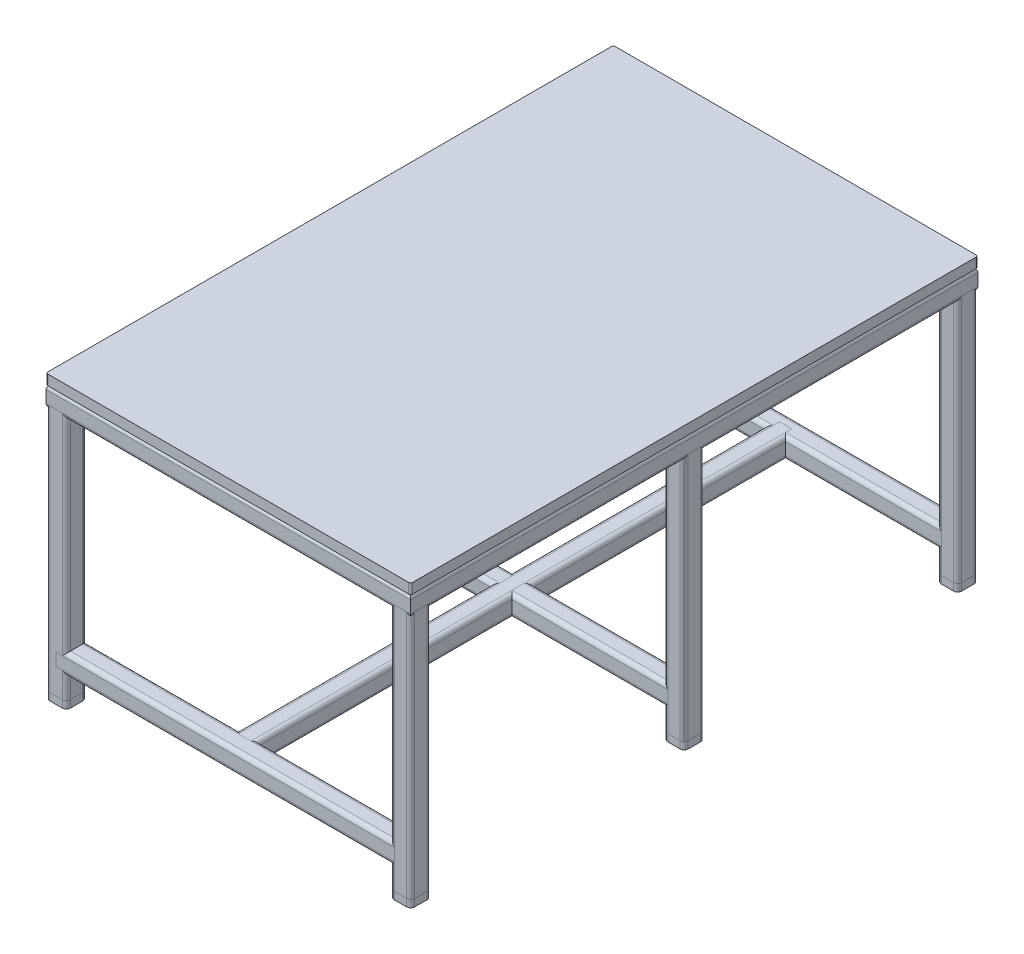
from build123d import *

# Parameters (mm, degrees)
SQUARE_TUBE_20_X_20_X_2_37_DEPTH      = 353.408396927
SQUARE_TUBE_20_X_20_X_2_37_DEPTH_BACK = 15.142135624
SQUARE_TUBE_20_X_20_X_2_37_2_DEPTH    = 567.662043607
SQUARE_TUBE_20_X_20_X_2_37_3_DEPTH    = 368.55053255
SQUARE_TUBE_20_X_20_X_2_37_4_DEPTH    = 567.662043607
SKETCH14_W                            = 358.266261302
SKETCH14_H                            = 557.377772359
BOSS_EXTRUDE1_DEPTH                   = 10
SQUARE_TUBE_20_X_20_X_2_6_DEPTH       = 250
SQUARE_TUBE_20_X_20_X_2_6_2_DEPTH     = 250
FILLET4_R                             = 2
SQUARE_TUBE_20_X_20_X_2_11_DEPTH      = 338.266261303
SQUARE_TUBE_20_X_20_X_2_44_DEPTH      = 250
SQUARE_TUBE_20_X_20_X_2_44_2_DEPTH    = 250
SQUARE_TUBE_20_X_20_X_2_44_3_DEPTH    = 250
SQUARE_TUBE_20_X_20_X_2_44_4_DEPTH    = 250
SQUARE_TUBE_20_X_20_X_2_44_5_DEPTH    = 250
SQUARE_TUBE_20_X_20_X_2_44_6_DEPTH    = 250
BOSS_EXTRUDE2_DEPTH                   = 7.127154383
BOSS_EXTRUDE2_2_DEPTH                 = 7.127154383
BOSS_EXTRUDE2_3_DEPTH                 = 7.127154383
BOSS_EXTRUDE2_4_DEPTH                 = 7.127154383
BOSS_EXTRUDE2_5_DEPTH                 = 7.127154383
BOSS_EXTRUDE2_6_DEPTH                 = 7.127154383
SQUARE_TUBE_20_X_20_X_2_46_DEPTH      = 338.266261303
SQUARE_TUBE_20_X_20_X_2_46_2_DEPTH    = 338.266261303
SQUARE_TUBE_20_X_20_X_2_46_3_DEPTH    = 338.266261303
SQUARE_TUBE_20_X_20_X_2_47_DEPTH      = 537.377772359


with BuildPart() as part:
    # Sketch116 → Square tube 20 X 20 X 2(37) (new, two sides: drawn at the far end of the back side and taken through both)
    with BuildSketch(Plane(origin=(-169.133130651, 187.127154383, 0), x_dir=(0, 1, 0), z_dir=(1, 0, 0)).offset(-SQUARE_TUBE_20_X_20_X_2_37_DEPTH_BACK)):
        with BuildLine():
            Line((-6, -10), (6, -10))
            ThreePointArc((6, -10), (8.828427125, -8.828427125), (10, -6))
            Line((10, -6), (10, 6))
            ThreePointArc((10, 6), (8.828427125, 8.828427125), (6, 10))
            Line((6, 10), (-6, 10))
            ThreePointArc((-6, 10), (-8.828427125, 8.828427125), (-10, 6))
            Line((-10, 6), (-10, -6))
            ThreePointArc((-10, -6), (-8.828427125, -8.828427125), (-6, -10))
        make_face()
        with BuildLine():
            Line((-6, -8), (6, -8))
            ThreePointArc((6, -8), (7.414213562, -7.414213562), (8, -6))
            Line((8, -6), (8, 6))
            ThreePointArc((8, 6), (7.414213562, 7.414213562), (6, 8))
            Line((6, 8), (-6, 8))
            ThreePointArc((-6, 8), (-7.414213562, 7.414213562), (-8, 6))
            Line((-8, 6), (-8, -6))
            ThreePointArc((-8, -6), (-7.414213562, -7.414213562), (-6, -8))
        make_face(mode=Mode.SUBTRACT)
    extrude(amount=SQUARE_TUBE_20_X_20_X_2_37_DEPTH + SQUARE_TUBE_20_X_20_X_2_37_DEPTH_BACK)

    # Square tube 20 X 20 X 2(37) mitre 1
    split(bisect_by=Plane(origin=(-169.133130651, 187.127154383, 0), x_dir=(0, 1, 0), z_dir=(0.707106781, 0, 0.707106781)), keep=Keep.TOP)

    # Square tube 20 X 20 X 2(37) mitre 2
    split(bisect_by=Plane(origin=(169.133130651, 187.127154383, 0), x_dir=(0, -1, 0), z_dir=(-0.707106781, 0, 0.707106781)), keep=Keep.TOP)


with BuildPart() as body_2:
    # Sketch116 on segment 2 (carried to segment 2) → Square tube 20 X 20 X 2_37 2 (new body)
    with BuildSketch(Plane(origin=(169.133130651, 187.127154383, 15.142135624), x_dir=(0, 1, 0), z_dir=(0, 0, -1))):
        with BuildLine():
            Line((-6, -10), (6, -10))
            ThreePointArc((6, -10), (8.828427125, -8.828427125), (10, -6))
            Line((10, -6), (10, 6))
            ThreePointArc((10, 6), (8.828427125, 8.828427125), (6, 10))
            Line((6, 10), (-6, 10))
            ThreePointArc((-6, 10), (-8.828427125, 8.828427125), (-10, 6))
            Line((-10, 6), (-10, -6))
            ThreePointArc((-10, -6), (-8.828427125, -8.828427125), (-6, -10))
        make_face()
        with BuildLine():
            Line((-6, -8), (6, -8))
            ThreePointArc((6, -8), (7.414213562, -7.414213562), (8, -6))
            Line((8, -6), (8, 6))
            ThreePointArc((8, 6), (7.414213562, 7.414213562), (6, 8))
            Line((6, 8), (-6, 8))
            ThreePointArc((-6, 8), (-7.414213562, 7.414213562), (-8, 6))
            Line((-8, 6), (-8, -6))
            ThreePointArc((-8, -6), (-7.414213562, -7.414213562), (-6, -8))
        make_face(mode=Mode.SUBTRACT)
    extrude(amount=SQUARE_TUBE_20_X_20_X_2_37_2_DEPTH)

    # Square tube 20 X 20 X 2_37 2 mitre 1
    split(bisect_by=Plane(origin=(169.133130651, 187.127154383, -537.377772359), x_dir=(0, 1, 0), z_dir=(0.707106781, 0, 0.707106781)), keep=Keep.TOP)

    # Square tube 20 X 20 X 2_37 2 mitre 2
    split(bisect_by=Plane(origin=(169.133130651, 187.127154383, 0), x_dir=(0, 1, 0), z_dir=(0.707106781, 0, -0.707106781)), keep=Keep.TOP)


with BuildPart() as body_3:
    # Sketch116 on segment 3 (carried to segment 3) → Square tube 20 X 20 X 2_37 3 (new body)
    with BuildSketch(Plane(origin=(184.275266275, 187.127154383, -537.377772359), x_dir=(0, 1, 0), z_dir=(-1, 0, 0))):
        with BuildLine():
            Line((-6, -10), (6, -10))
            ThreePointArc((6, -10), (8.828427125, -8.828427125), (10, -6))
            Line((10, -6), (10, 6))
            ThreePointArc((10, 6), (8.828427125, 8.828427125), (6, 10))
            Line((6, 10), (-6, 10))
            ThreePointArc((-6, 10), (-8.828427125, 8.828427125), (-10, 6))
            Line((-10, 6), (-10, -6))
            ThreePointArc((-10, -6), (-8.828427125, -8.828427125), (-6, -10))
        make_face()
        with BuildLine():
            Line((-6, -8), (6, -8))
            ThreePointArc((6, -8), (7.414213562, -7.414213562), (8, -6))
            Line((8, -6), (8, 6))
            ThreePointArc((8, 6), (7.414213562, 7.414213562), (6, 8))
            Line((6, 8), (-6, 8))
            ThreePointArc((-6, 8), (-7.414213562, 7.414213562), (-8, 6))
            Line((-8, 6), (-8, -6))
            ThreePointArc((-8, -6), (-7.414213562, -7.414213562), (-6, -8))
        make_face(mode=Mode.SUBTRACT)
    extrude(amount=SQUARE_TUBE_20_X_20_X_2_37_3_DEPTH)

    # Square tube 20 X 20 X 2_37 3 mitre 1
    split(bisect_by=Plane(origin=(-169.133130651, 187.127154383, -537.377772359), x_dir=(0, 1, 0), z_dir=(0.707106781, 0, -0.707106781)), keep=Keep.TOP)

    # Square tube 20 X 20 X 2_37 3 mitre 2
    split(bisect_by=Plane(origin=(169.133130651, 187.127154383, -537.377772359), x_dir=(0, -1, 0), z_dir=(-0.707106781, 0, -0.707106781)), keep=Keep.TOP)


with BuildPart() as body_4:
    # Sketch116 on segment 4 (carried to segment 4) → Square tube 20 X 20 X 2_37 4 (new body)
    with BuildSketch(Plane(origin=(-169.133130651, 187.127154383, -552.519907983), x_dir=(0, 1, 0), z_dir=(0, 0, 1))):
        with BuildLine():
            Line((-6, -10), (6, -10))
            ThreePointArc((6, -10), (8.828427125, -8.828427125), (10, -6))
            Line((10, -6), (10, 6))
            ThreePointArc((10, 6), (8.828427125, 8.828427125), (6, 10))
            Line((6, 10), (-6, 10))
            ThreePointArc((-6, 10), (-8.828427125, 8.828427125), (-10, 6))
            Line((-10, 6), (-10, -6))
            ThreePointArc((-10, -6), (-8.828427125, -8.828427125), (-6, -10))
        make_face()
        with BuildLine():
            Line((-6, -8), (6, -8))
            ThreePointArc((6, -8), (7.414213562, -7.414213562), (8, -6))
            Line((8, -6), (8, 6))
            ThreePointArc((8, 6), (7.414213562, 7.414213562), (6, 8))
            Line((6, 8), (-6, 8))
            ThreePointArc((-6, 8), (-7.414213562, 7.414213562), (-8, 6))
            Line((-8, 6), (-8, -6))
            ThreePointArc((-8, -6), (-7.414213562, -7.414213562), (-6, -8))
        make_face(mode=Mode.SUBTRACT)
    extrude(amount=SQUARE_TUBE_20_X_20_X_2_37_4_DEPTH)

    # Square tube 20 X 20 X 2_37 4 mitre 1
    split(bisect_by=Plane(origin=(-169.133130651, 187.127154383, 0), x_dir=(0, -1, 0), z_dir=(-0.707106781, 0, -0.707106781)), keep=Keep.TOP)

    # Square tube 20 X 20 X 2_37 4 mitre 2
    split(bisect_by=Plane(origin=(-169.133130651, 187.127154383, -537.377772359), x_dir=(0, -1, 0), z_dir=(-0.707106781, 0, 0.707106781)), keep=Keep.TOP)


with BuildPart() as body_5:
    # Sketch14 → Boss-Extrude1 (new body)
    with BuildSketch(Plane(origin=(0, 197.127154383, 0), x_dir=(1, 0, 0), z_dir=(0, 1, 0))):
        with Locations((0, 268.68888618)):
            Rectangle(SKETCH14_W, SKETCH14_H)
    extrude(amount=BOSS_EXTRUDE1_DEPTH)

    # Fillet4
    fillet4_edges = [body_5.edges().sort_by_distance(p)[0] for p in [
        (179.133130651, 202.127154383, 10),
        (-179.133130651, 202.127154383, 10),
        (-179.133130651, 202.127154383, -547.377772359),
        (179.133130651, 202.127154383, -547.377772359),
    ]]
    fillet(fillet4_edges, radius=FILLET4_R)


with BuildPart() as body_6:
    # Sketch18 → Square tube 20 X 20 X 2(6) (new body)
    with BuildSketch(Plane(origin=(-169.133130651, 187.127154383, -268.68888618), x_dir=(1, 0, 0), z_dir=(0, -1, 0))):
        with BuildLine():
            Line((-6, -10), (6, -10))
            ThreePointArc((6, -10), (8.828427125, -8.828427125), (10, -6))
            Line((10, -6), (10, 6))
            ThreePointArc((10, 6), (8.828427125, 8.828427125), (6, 10))
            Line((6, 10), (-6, 10))
            ThreePointArc((-6, 10), (-8.828427125, 8.828427125), (-10, 6))
            Line((-10, 6), (-10, -6))
            ThreePointArc((-10, -6), (-8.828427125, -8.828427125), (-6, -10))
        make_face()
        with BuildLine():
            Line((-6, -8), (6, -8))
            ThreePointArc((6, -8), (7.414213562, -7.414213562), (8, -6))
            Line((8, -6), (8, 6))
            ThreePointArc((8, 6), (7.414213562, 7.414213562), (6, 8))
            Line((6, 8), (-6, 8))
            ThreePointArc((-6, 8), (-7.414213562, 7.414213562), (-8, 6))
            Line((-8, 6), (-8, -6))
            ThreePointArc((-8, -6), (-7.414213562, -7.414213562), (-6, -8))
        make_face(mode=Mode.SUBTRACT)
    extrude(amount=SQUARE_TUBE_20_X_20_X_2_6_DEPTH)


with BuildPart() as body_7:
    # Sketch18 on segment 2 (carried to segment 2) → Square tube 20 X 20 X 2_6 2 (new body)
    with BuildSketch(Plane(origin=(169.133130651, 187.127154383, -268.68888618), x_dir=(1, 0, 0), z_dir=(0, -1, 0))):
        with BuildLine():
            Line((-6, -10), (6, -10))
            ThreePointArc((6, -10), (8.828427125, -8.828427125), (10, -6))
            Line((10, -6), (10, 6))
            ThreePointArc((10, 6), (8.828427125, 8.828427125), (6, 10))
            Line((6, 10), (-6, 10))
            ThreePointArc((-6, 10), (-8.828427125, 8.828427125), (-10, 6))
            Line((-10, 6), (-10, -6))
            ThreePointArc((-10, -6), (-8.828427125, -8.828427125), (-6, -10))
        make_face()
        with BuildLine():
            Line((-6, -8), (6, -8))
            ThreePointArc((6, -8), (7.414213562, -7.414213562), (8, -6))
            Line((8, -6), (8, 6))
            ThreePointArc((8, 6), (7.414213562, 7.414213562), (6, 8))
            Line((6, 8), (-6, 8))
            ThreePointArc((-6, 8), (-7.414213562, 7.414213562), (-8, 6))
            Line((-8, 6), (-8, -6))
            ThreePointArc((-8, -6), (-7.414213562, -7.414213562), (-6, -8))
        make_face(mode=Mode.SUBTRACT)
    extrude(amount=SQUARE_TUBE_20_X_20_X_2_6_2_DEPTH)


with BuildPart() as body_8:
    # Sketch110 → Square tube 20 X 20 X 2(11) (new body)
    with BuildSketch(Plane(origin=(-169.133130651, -31.487021705, -268.68888618), x_dir=(0, 0, -1), z_dir=(1, 0, 0))):
        with BuildLine():
            Line((-6, -10), (6, -10))
            ThreePointArc((6, -10), (8.828427125, -8.828427125), (10, -6))
            Line((10, -6), (10, 6))
            ThreePointArc((10, 6), (8.828427125, 8.828427125), (6, 10))
            Line((6, 10), (-6, 10))
            ThreePointArc((-6, 10), (-8.828427125, 8.828427125), (-10, 6))
            Line((-10, 6), (-10, -6))
            ThreePointArc((-10, -6), (-8.828427125, -8.828427125), (-6, -10))
        make_face()
        with BuildLine():
            Line((-6, -8), (6, -8))
            ThreePointArc((6, -8), (7.414213562, -7.414213562), (8, -6))
            Line((8, -6), (8, 6))
            ThreePointArc((8, 6), (7.414213562, 7.414213562), (6, 8))
            Line((6, 8), (-6, 8))
            ThreePointArc((-6, 8), (-7.414213562, 7.414213562), (-8, 6))
            Line((-8, 6), (-8, -6))
            ThreePointArc((-8, -6), (-7.414213562, -7.414213562), (-6, -8))
        make_face(mode=Mode.SUBTRACT)
    extrude(amount=SQUARE_TUBE_20_X_20_X_2_11_DEPTH)


with BuildPart() as body_9:
    # Sketch118 → Square tube 20 X 20 X 2(44) (new body)
    with BuildSketch(Plane(origin=(-169.133130651, 187.127154383, 0), x_dir=(1, 0, 0), z_dir=(0, -1, 0))):
        with BuildLine():
            Line((-6, -10), (6, -10))
            ThreePointArc((6, -10), (8.828427125, -8.828427125), (10, -6))
            Line((10, -6), (10, 6))
            ThreePointArc((10, 6), (8.828427125, 8.828427125), (6, 10))
            Line((6, 10), (-6, 10))
            ThreePointArc((-6, 10), (-8.828427125, 8.828427125), (-10, 6))
            Line((-10, 6), (-10, -6))
            ThreePointArc((-10, -6), (-8.828427125, -8.828427125), (-6, -10))
        make_face()
        with BuildLine():
            Line((-6, -8), (6, -8))
            ThreePointArc((6, -8), (7.414213562, -7.414213562), (8, -6))
            Line((8, -6), (8, 6))
            ThreePointArc((8, 6), (7.414213562, 7.414213562), (6, 8))
            Line((6, 8), (-6, 8))
            ThreePointArc((-6, 8), (-7.414213562, 7.414213562), (-8, 6))
            Line((-8, 6), (-8, -6))
            ThreePointArc((-8, -6), (-7.414213562, -7.414213562), (-6, -8))
        make_face(mode=Mode.SUBTRACT)
    extrude(amount=SQUARE_TUBE_20_X_20_X_2_44_DEPTH)


with BuildPart() as body_10:
    # Sketch118 on segment 2 (carried to segment 2) → Square tube 20 X 20 X 2_44 2 (new body)
    with BuildSketch(Plane(origin=(169.133130651, 187.127154383, 0), x_dir=(1, 0, 0), z_dir=(0, -1, 0))):
        with BuildLine():
            Line((-6, -10), (6, -10))
            ThreePointArc((6, -10), (8.828427125, -8.828427125), (10, -6))
            Line((10, -6), (10, 6))
            ThreePointArc((10, 6), (8.828427125, 8.828427125), (6, 10))
            Line((6, 10), (-6, 10))
            ThreePointArc((-6, 10), (-8.828427125, 8.828427125), (-10, 6))
            Line((-10, 6), (-10, -6))
            ThreePointArc((-10, -6), (-8.828427125, -8.828427125), (-6, -10))
        make_face()
        with BuildLine():
            Line((-6, -8), (6, -8))
            ThreePointArc((6, -8), (7.414213562, -7.414213562), (8, -6))
            Line((8, -6), (8, 6))
            ThreePointArc((8, 6), (7.414213562, 7.414213562), (6, 8))
            Line((6, 8), (-6, 8))
            ThreePointArc((-6, 8), (-7.414213562, 7.414213562), (-8, 6))
            Line((-8, 6), (-8, -6))
            ThreePointArc((-8, -6), (-7.414213562, -7.414213562), (-6, -8))
        make_face(mode=Mode.SUBTRACT)
    extrude(amount=SQUARE_TUBE_20_X_20_X_2_44_2_DEPTH)


with BuildPart() as body_11:
    # Sketch118 on segment 3 (carried to segment 3) → Square tube 20 X 20 X 2_44 3 (new body)
    with BuildSketch(Plane(origin=(169.133130651, 187.127154383, -537.377772359), x_dir=(1, 0, 0), z_dir=(0, -1, 0))):
        with BuildLine():
            Line((-6, -10), (6, -10))
            ThreePointArc((6, -10), (8.828427125, -8.828427125), (10, -6))
            Line((10, -6), (10, 6))
            ThreePointArc((10, 6), (8.828427125, 8.828427125), (6, 10))
            Line((6, 10), (-6, 10))
            ThreePointArc((-6, 10), (-8.828427125, 8.828427125), (-10, 6))
            Line((-10, 6), (-10, -6))
            ThreePointArc((-10, -6), (-8.828427125, -8.828427125), (-6, -10))
        make_face()
        with BuildLine():
            Line((-6, -8), (6, -8))
            ThreePointArc((6, -8), (7.414213562, -7.414213562), (8, -6))
            Line((8, -6), (8, 6))
            ThreePointArc((8, 6), (7.414213562, 7.414213562), (6, 8))
            Line((6, 8), (-6, 8))
            ThreePointArc((-6, 8), (-7.414213562, 7.414213562), (-8, 6))
            Line((-8, 6), (-8, -6))
            ThreePointArc((-8, -6), (-7.414213562, -7.414213562), (-6, -8))
        make_face(mode=Mode.SUBTRACT)
    extrude(amount=SQUARE_TUBE_20_X_20_X_2_44_3_DEPTH)


with BuildPart() as body_12:
    # Sketch118 on segment 4 (carried to segment 4) → Square tube 20 X 20 X 2_44 4 (new body)
    with BuildSketch(Plane(origin=(-169.133130651, 187.127154383, -537.377772359), x_dir=(1, 0, 0), z_dir=(0, -1, 0))):
        with BuildLine():
            Line((-6, -10), (6, -10))
            ThreePointArc((6, -10), (8.828427125, -8.828427125), (10, -6))
            Line((10, -6), (10, 6))
            ThreePointArc((10, 6), (8.828427125, 8.828427125), (6, 10))
            Line((6, 10), (-6, 10))
            ThreePointArc((-6, 10), (-8.828427125, 8.828427125), (-10, 6))
            Line((-10, 6), (-10, -6))
            ThreePointArc((-10, -6), (-8.828427125, -8.828427125), (-6, -10))
        make_face()
        with BuildLine():
            Line((-6, -8), (6, -8))
            ThreePointArc((6, -8), (7.414213562, -7.414213562), (8, -6))
            Line((8, -6), (8, 6))
            ThreePointArc((8, 6), (7.414213562, 7.414213562), (6, 8))
            Line((6, 8), (-6, 8))
            ThreePointArc((-6, 8), (-7.414213562, 7.414213562), (-8, 6))
            Line((-8, 6), (-8, -6))
            ThreePointArc((-8, -6), (-7.414213562, -7.414213562), (-6, -8))
        make_face(mode=Mode.SUBTRACT)
    extrude(amount=SQUARE_TUBE_20_X_20_X_2_44_4_DEPTH)


with BuildPart() as body_13:
    # Sketch118 on segment 5 (carried to segment 5) → Square tube 20 X 20 X 2_44 5 (new body)
    with BuildSketch(Plane(origin=(-169.133130651, 187.127154383, -268.68888618), x_dir=(1, 0, 0), z_dir=(0, -1, 0))):
        with BuildLine():
            Line((-6, -10), (6, -10))
            ThreePointArc((6, -10), (8.828427125, -8.828427125), (10, -6))
            Line((10, -6), (10, 6))
            ThreePointArc((10, 6), (8.828427125, 8.828427125), (6, 10))
            Line((6, 10), (-6, 10))
            ThreePointArc((-6, 10), (-8.828427125, 8.828427125), (-10, 6))
            Line((-10, 6), (-10, -6))
            ThreePointArc((-10, -6), (-8.828427125, -8.828427125), (-6, -10))
        make_face()
        with BuildLine():
            Line((-6, -8), (6, -8))
            ThreePointArc((6, -8), (7.414213562, -7.414213562), (8, -6))
            Line((8, -6), (8, 6))
            ThreePointArc((8, 6), (7.414213562, 7.414213562), (6, 8))
            Line((6, 8), (-6, 8))
            ThreePointArc((-6, 8), (-7.414213562, 7.414213562), (-8, 6))
            Line((-8, 6), (-8, -6))
            ThreePointArc((-8, -6), (-7.414213562, -7.414213562), (-6, -8))
        make_face(mode=Mode.SUBTRACT)
    extrude(amount=SQUARE_TUBE_20_X_20_X_2_44_5_DEPTH)


with BuildPart() as body_14:
    # Sketch118 on segment 6 (carried to segment 6) → Square tube 20 X 20 X 2_44 6 (new body)
    with BuildSketch(Plane(origin=(169.133130651, 187.127154383, -268.68888618), x_dir=(1, 0, 0), z_dir=(0, -1, 0))):
        with BuildLine():
            Line((-6, -10), (6, -10))
            ThreePointArc((6, -10), (8.828427125, -8.828427125), (10, -6))
            Line((10, -6), (10, 6))
            ThreePointArc((10, 6), (8.828427125, 8.828427125), (6, 10))
            Line((6, 10), (-6, 10))
            ThreePointArc((-6, 10), (-8.828427125, 8.828427125), (-10, 6))
            Line((-10, 6), (-10, -6))
            ThreePointArc((-10, -6), (-8.828427125, -8.828427125), (-6, -10))
        make_face()
        with BuildLine():
            Line((-6, -8), (6, -8))
            ThreePointArc((6, -8), (7.414213562, -7.414213562), (8, -6))
            Line((8, -6), (8, 6))
            ThreePointArc((8, 6), (7.414213562, 7.414213562), (6, 8))
            Line((6, 8), (-6, 8))
            ThreePointArc((-6, 8), (-7.414213562, 7.414213562), (-8, 6))
            Line((-8, 6), (-8, -6))
            ThreePointArc((-8, -6), (-7.414213562, -7.414213562), (-6, -8))
        make_face(mode=Mode.SUBTRACT)
    extrude(amount=SQUARE_TUBE_20_X_20_X_2_44_6_DEPTH)


with BuildPart() as body_15:
    # Sketch119 → Boss-Extrude2 (new body)
    with BuildSketch(Plane(origin=(0, -70, 0), x_dir=(1, 0, 0), z_dir=(0, 1, 0))):
        with BuildLine():
            Line((-163.133130651, 527.377772359), (-175.133130651, 527.377772359))
            ThreePointArc((-175.133130651, 527.377772359), (-177.961557776, 528.549345235), (-179.133130651, 531.377772359))
            Line((-179.133130651, 531.377772359), (-179.133130651, 543.377772359))
            ThreePointArc((-179.133130651, 543.377772359), (-177.961557776, 546.206199484), (-175.133130651, 547.377772359))
            Line((-175.133130651, 547.377772359), (-163.133130651, 547.377772359))
            ThreePointArc((-163.133130651, 547.377772359), (-160.304703527, 546.206199484), (-159.133130651, 543.377772359))
            Line((-159.133130651, 543.377772359), (-159.133130651, 531.377772359))
            ThreePointArc((-159.133130651, 531.377772359), (-160.304703527, 528.549345235), (-163.133130651, 527.377772359))
        make_face()
    extrude(amount=BOSS_EXTRUDE2_DEPTH)


with BuildPart() as body_16:
    # Sketch119 → Boss-Extrude2 2 (new body)
    with BuildSketch(Plane(origin=(0, -70, 0), x_dir=(1, 0, 0), z_dir=(0, 1, 0))):
        with BuildLine():
            Line((175.133130651, 527.377772359), (163.133130651, 527.377772359))
            ThreePointArc((163.133130651, 527.377772359), (160.304703527, 528.549345235), (159.133130651, 531.377772359))
            Line((159.133130651, 531.377772359), (159.133130651, 543.377772359))
            ThreePointArc((159.133130651, 543.377772359), (160.304703527, 546.206199484), (163.133130651, 547.377772359))
            Line((163.133130651, 547.377772359), (175.133130651, 547.377772359))
            ThreePointArc((175.133130651, 547.377772359), (177.961557776, 546.206199484), (179.133130651, 543.377772359))
            Line((179.133130651, 543.377772359), (179.133130651, 531.377772359))
            ThreePointArc((179.133130651, 531.377772359), (177.961557776, 528.549345235), (175.133130651, 527.377772359))
        make_face()
    extrude(amount=BOSS_EXTRUDE2_2_DEPTH)


with BuildPart() as body_17:
    # Sketch119 → Boss-Extrude2 3 (new body)
    with BuildSketch(Plane(origin=(0, -70, 0), x_dir=(1, 0, 0), z_dir=(0, 1, 0))):
        with BuildLine():
            Line((175.133130651, 258.68888618), (163.133130651, 258.68888618))
            ThreePointArc((163.133130651, 258.68888618), (160.304703527, 259.860459055), (159.133130651, 262.68888618))
            Line((159.133130651, 262.68888618), (159.133130651, 274.68888618))
            ThreePointArc((159.133130651, 274.68888618), (160.304703527, 277.517313304), (163.133130651, 278.68888618))
            Line((163.133130651, 278.68888618), (175.133130651, 278.68888618))
            ThreePointArc((175.133130651, 278.68888618), (177.961557776, 277.517313304), (179.133130651, 274.68888618))
            Line((179.133130651, 274.68888618), (179.133130651, 262.68888618))
            ThreePointArc((179.133130651, 262.68888618), (177.961557776, 259.860459055), (175.133130651, 258.68888618))
        make_face()
    extrude(amount=BOSS_EXTRUDE2_3_DEPTH)


with BuildPart() as body_18:
    # Sketch119 → Boss-Extrude2 4 (new body)
    with BuildSketch(Plane(origin=(0, -70, 0), x_dir=(1, 0, 0), z_dir=(0, 1, 0))):
        with BuildLine():
            Line((175.133130651, -10), (163.133130651, -10))
            ThreePointArc((163.133130651, -10), (160.304703527, -8.828427125), (159.133130651, -6))
            Line((159.133130651, -6), (159.133130651, 6))
            ThreePointArc((159.133130651, 6), (160.304703527, 8.828427125), (163.133130651, 10))
            Line((163.133130651, 10), (175.133130651, 10))
            ThreePointArc((175.133130651, 10), (177.961557776, 8.828427125), (179.133130651, 6))
            Line((179.133130651, 6), (179.133130651, -6))
            ThreePointArc((179.133130651, -6), (177.961557776, -8.828427125), (175.133130651, -10))
        make_face()
    extrude(amount=BOSS_EXTRUDE2_4_DEPTH)


with BuildPart() as body_19:
    # Sketch119 → Boss-Extrude2 5 (new body)
    with BuildSketch(Plane(origin=(0, -70, 0), x_dir=(1, 0, 0), z_dir=(0, 1, 0))):
        with BuildLine():
            Line((-163.133130651, -10), (-175.133130651, -10))
            ThreePointArc((-175.133130651, -10), (-177.961557776, -8.828427125), (-179.133130651, -6))
            Line((-179.133130651, -6), (-179.133130651, 6))
            ThreePointArc((-179.133130651, 6), (-177.961557776, 8.828427125), (-175.133130651, 10))
            Line((-175.133130651, 10), (-163.133130651, 10))
            ThreePointArc((-163.133130651, 10), (-160.304703527, 8.828427125), (-159.133130651, 6))
            Line((-159.133130651, 6), (-159.133130651, -6))
            ThreePointArc((-159.133130651, -6), (-160.304703527, -8.828427125), (-163.133130651, -10))
        make_face()
    extrude(amount=BOSS_EXTRUDE2_5_DEPTH)


with BuildPart() as body_20:
    # Sketch119 → Boss-Extrude2 6 (new body)
    with BuildSketch(Plane(origin=(0, -70, 0), x_dir=(1, 0, 0), z_dir=(0, 1, 0))):
        with BuildLine():
            Line((-163.133130651, 258.68888618), (-175.133130651, 258.68888618))
            ThreePointArc((-175.133130651, 258.68888618), (-177.961557776, 259.860459055), (-179.133130651, 262.68888618))
            Line((-179.133130651, 262.68888618), (-179.133130651, 274.68888618))
            ThreePointArc((-179.133130651, 274.68888618), (-177.961557776, 277.517313304), (-175.133130651, 278.68888618))
            Line((-175.133130651, 278.68888618), (-163.133130651, 278.68888618))
            ThreePointArc((-163.133130651, 278.68888618), (-160.304703527, 277.517313304), (-159.133130651, 274.68888618))
            Line((-159.133130651, 274.68888618), (-159.133130651, 262.68888618))
            ThreePointArc((-159.133130651, 262.68888618), (-160.304703527, 259.860459055), (-163.133130651, 258.68888618))
        make_face()
    extrude(amount=BOSS_EXTRUDE2_6_DEPTH)


with BuildPart() as body_21:
    # Sketch121 → Square tube 20 X 20 X 2(46) (new body)
    with BuildSketch(Plane(origin=(-169.133130651, -31.487021705, 0), x_dir=(0, 1, 0), z_dir=(1, 0, 0))):
        with BuildLine():
            Line((-6, -10), (6, -10))
            ThreePointArc((6, -10), (8.828427125, -8.828427125), (10, -6))
            Line((10, -6), (10, 6))
            ThreePointArc((10, 6), (8.828427125, 8.828427125), (6, 10))
            Line((6, 10), (-6, 10))
            ThreePointArc((-6, 10), (-8.828427125, 8.828427125), (-10, 6))
            Line((-10, 6), (-10, -6))
            ThreePointArc((-10, -6), (-8.828427125, -8.828427125), (-6, -10))
        make_face()
        with BuildLine():
            Line((-6, -8), (6, -8))
            ThreePointArc((6, -8), (7.414213562, -7.414213562), (8, -6))
            Line((8, -6), (8, 6))
            ThreePointArc((8, 6), (7.414213562, 7.414213562), (6, 8))
            Line((6, 8), (-6, 8))
            ThreePointArc((-6, 8), (-7.414213562, 7.414213562), (-8, 6))
            Line((-8, 6), (-8, -6))
            ThreePointArc((-8, -6), (-7.414213562, -7.414213562), (-6, -8))
        make_face(mode=Mode.SUBTRACT)
    extrude(amount=SQUARE_TUBE_20_X_20_X_2_46_DEPTH)


with BuildPart() as body_22:
    # Sketch121 on segment 2 (carried to segment 2) → Square tube 20 X 20 X 2_46 2 (new body)
    with BuildSketch(Plane(origin=(-169.133130651, 187.127154383, -537.377772359), x_dir=(0, 1, 0), z_dir=(1, 0, 0))):
        with BuildLine():
            Line((-6, -10), (6, -10))
            ThreePointArc((6, -10), (8.828427125, -8.828427125), (10, -6))
            Line((10, -6), (10, 6))
            ThreePointArc((10, 6), (8.828427125, 8.828427125), (6, 10))
            Line((6, 10), (-6, 10))
            ThreePointArc((-6, 10), (-8.828427125, 8.828427125), (-10, 6))
            Line((-10, 6), (-10, -6))
            ThreePointArc((-10, -6), (-8.828427125, -8.828427125), (-6, -10))
        make_face()
        with BuildLine():
            Line((-6, -8), (6, -8))
            ThreePointArc((6, -8), (7.414213562, -7.414213562), (8, -6))
            Line((8, -6), (8, 6))
            ThreePointArc((8, 6), (7.414213562, 7.414213562), (6, 8))
            Line((6, 8), (-6, 8))
            ThreePointArc((-6, 8), (-7.414213562, 7.414213562), (-8, 6))
            Line((-8, 6), (-8, -6))
            ThreePointArc((-8, -6), (-7.414213562, -7.414213562), (-6, -8))
        make_face(mode=Mode.SUBTRACT)
    extrude(amount=SQUARE_TUBE_20_X_20_X_2_46_2_DEPTH)


with BuildPart() as body_23:
    # Sketch121 on segment 3 (carried to segment 3) → Square tube 20 X 20 X 2_46 3 (new body)
    with BuildSketch(Plane(origin=(-169.133130651, -31.487021705, -537.377772359), x_dir=(0, 1, 0), z_dir=(1, 0, 0))):
        with BuildLine():
            Line((-6, -10), (6, -10))
            ThreePointArc((6, -10), (8.828427125, -8.828427125), (10, -6))
            Line((10, -6), (10, 6))
            ThreePointArc((10, 6), (8.828427125, 8.828427125), (6, 10))
            Line((6, 10), (-6, 10))
            ThreePointArc((-6, 10), (-8.828427125, 8.828427125), (-10, 6))
            Line((-10, 6), (-10, -6))
            ThreePointArc((-10, -6), (-8.828427125, -8.828427125), (-6, -10))
        make_face()
        with BuildLine():
            Line((-6, -8), (6, -8))
            ThreePointArc((6, -8), (7.414213562, -7.414213562), (8, -6))
            Line((8, -6), (8, 6))
            ThreePointArc((8, 6), (7.414213562, 7.414213562), (6, 8))
            Line((6, 8), (-6, 8))
            ThreePointArc((-6, 8), (-7.414213562, 7.414213562), (-8, 6))
            Line((-8, 6), (-8, -6))
            ThreePointArc((-8, -6), (-7.414213562, -7.414213562), (-6, -8))
        make_face(mode=Mode.SUBTRACT)
    extrude(amount=SQUARE_TUBE_20_X_20_X_2_46_3_DEPTH)


with BuildPart() as body_24:
    # Sketch122 → Square tube 20 X 20 X 2(47) (new body)
    with BuildSketch(Plane(origin=(0, -31.487021705, 0), x_dir=(1, 0, 0), z_dir=(0, 0, -1))):
        with BuildLine():
            Line((-6, -10), (6, -10))
            ThreePointArc((6, -10), (8.828427125, -8.828427125), (10, -6))
            Line((10, -6), (10, 6))
            ThreePointArc((10, 6), (8.828427125, 8.828427125), (6, 10))
            Line((6, 10), (-6, 10))
            ThreePointArc((-6, 10), (-8.828427125, 8.828427125), (-10, 6))
            Line((-10, 6), (-10, -6))
            ThreePointArc((-10, -6), (-8.828427125, -8.828427125), (-6, -10))
        make_face()
        with BuildLine():
            Line((-6, -8), (6, -8))
            ThreePointArc((6, -8), (7.414213562, -7.414213562), (8, -6))
            Line((8, -6), (8, 6))
            ThreePointArc((8, 6), (7.414213562, 7.414213562), (6, 8))
            Line((6, 8), (-6, 8))
            ThreePointArc((-6, 8), (-7.414213562, 7.414213562), (-8, 6))
            Line((-8, 6), (-8, -6))
            ThreePointArc((-8, -6), (-7.414213562, -7.414213562), (-6, -8))
        make_face(mode=Mode.SUBTRACT)
    extrude(amount=SQUARE_TUBE_20_X_20_X_2_47_DEPTH)


solid = Compound([part.part, body_2.part, body_3.part, body_4.part, body_5.part, body_6.part, body_7.part, body_8.part, body_9.part, body_10.part, body_11.part, body_12.part, body_13.part, body_14.part, body_15.part, body_16.part, body_17.part, body_18.part, body_19.part, body_20.part, body_21.part, body_22.part, body_23.part, body_24.part])
